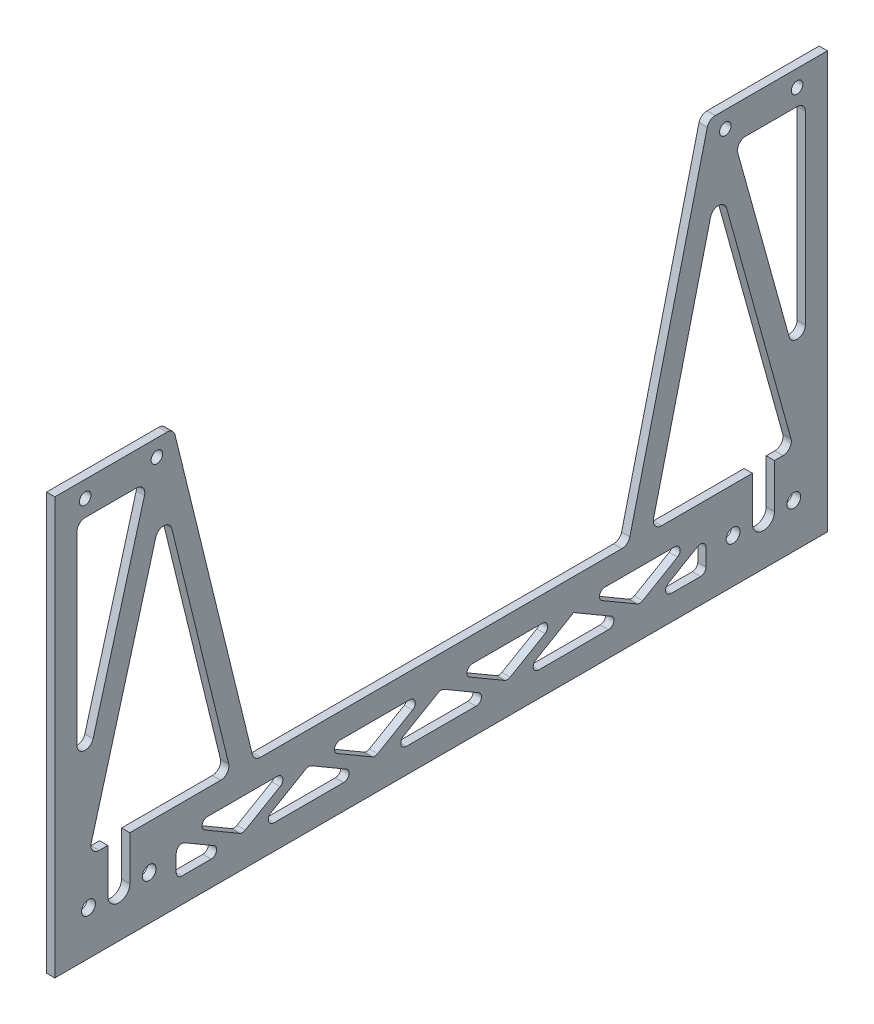
from build123d import *

# Parameters (mm, degrees)
SKETCH1_R           = 1.05
BOSS_EXTRUDE1_DEPTH = 1.5
FILLET1_R           = 1.5
SKETCH2_R           = 1.05
SKETCH2_W           = 4
SKETCH2_H           = 16
BOSS_EXTRUDE2_DEPTH = 1.5
SKETCH4_R           = 1.25
CUT_EXTRUDE2_DEPTH  = 160.067595694
CUT_EXTRUDE4_DEPTH  = 160.067595694
FILLET3_R           = 1
CUT_EXTRUDE5_DEPTH  = 160.067595694
BOSS_EXTRUDE3_DEPTH = 1.5
FILLET4_R           = 1.5


with BuildPart() as part:
    # Sketch1 → Boss-Extrude1 (new body)
    with BuildSketch(Plane(origin=(0, 0, 0), x_dir=(0, 0, -1), z_dir=(1, 0, 0))):
        Polygon((0, 0), (0, 75.5), (21.5, 75.5), (40, 0), (35.881667859, 0), (29.755840045, 25), (4, 25), (4, 0), align=None)
        with Locations((5.5, 72.5)):
            Circle(SKETCH1_R, mode=Mode.SUBTRACT)
        with Locations((18.5, 72.5)):
            Circle(SKETCH1_R, mode=Mode.SUBTRACT)
        Polygon((4, 69.5), (18.851866535, 69.5), (4, 29), align=None, mode=Mode.SUBTRACT)
        Polygon((8.260475549, 29), (20.558388216, 62.535546651), (28.775707595, 29), align=None, mode=Mode.SUBTRACT)
    extrude(amount=BOSS_EXTRUDE1_DEPTH)

    # Fillet1
    fillet1_edges = [part.edges().sort_by_distance(p)[0] for p in [
        (0.75, 75.5, -21.5),
        (0.75, 25, -29.755840045),
        (0.75, 25, -4),
        (0.75, 69.5, -4),
        (0.75, 29, -4),
        (0.75, 69.5, -18.851866535),
        (0.75, 29, -8.260475549),
        (0.75, 29, -28.775707595),
        (0.75, 62.535546651, -20.558388216),
    ]]
    fillet(fillet1_edges, radius=FILLET1_R)

    # Sketch2 → Boss-Extrude2 (add)
    # profile 1 of 5: a face of its own
    with BuildSketch(Plane(origin=(1.5, 0, 0), x_dir=(0, 0, -1), z_dir=(1, 0, 0))):
        Polygon((70, 0), (70, 16), (36.079470199, 16), (40, 0), align=None)
    # profile 2 of 5: a face of its own
    with BuildSketch(Plane(origin=(1.5, 0, 0), x_dir=(0, 0, -1), z_dir=(1, 0, 0))):
        with BuildLine():
            Line((103.920529801, 16), (70, 16))
            Line((70, 16), (70, 0))
            Line((70, 0), (140, 0))
            Line((140, 0), (140, 16))
            Line((140, 16), (140, 75.5))
            Line((140, 75.5), (119.676824884, 75.5))
            ThreePointArc((119.676824884, 75.5), (118.750942408, 75.180144754), (118.219924421, 74.356988855))
            Line((118.219924421, 74.356988855), (103.920529801, 16))
        make_face()
        with BuildLine():
            Line((108.038861942, 16), (109.964084377, 23.856988855))
            ThreePointArc((109.964084377, 23.856988855), (110.495102363, 24.680144754), (111.420984839, 25))
            Line((111.420984839, 25), (134.5, 25))
            ThreePointArc((134.5, 25), (135.560660172, 24.560660172), (136, 23.5))
            Line((136, 23.5), (136, 16))
            Line((136, 16), (108.038861942, 16))
        make_face(mode=Mode.SUBTRACT)
        with BuildLine():
            ThreePointArc((131.000070484, 31.016439186), (130.821545012, 29.641122471), (129.591776989, 29))
            Line((129.591776989, 29), (113.136216627, 29))
            ThreePointArc((113.136216627, 29), (111.956071873, 29.574117524), (111.679316165, 30.856988855))
            Line((111.679316165, 30.856988855), (118.270545293, 57.756329353))
            ThreePointArc((118.270545293, 57.756329353), (119.644098522, 58.897023121), (121.135739251, 57.915779684))
            Line((121.135739251, 57.915779684), (131.000070484, 31.016439186))
        make_face(mode=Mode.SUBTRACT)
        with BuildLine():
            ThreePointArc((121.887587432, 67.483560814), (122.066112904, 68.858877529), (123.295880927, 69.5))
            Line((123.295880927, 69.5), (134.5, 69.5))
            ThreePointArc((134.5, 69.5), (135.560660172, 69.060660172), (136, 68))
            Line((136, 68), (136, 37.447151885))
            ThreePointArc((136, 37.447151885), (134.762259183, 35.970256452), (133.091706505, 36.930712699))
            Line((133.091706505, 36.930712699), (121.887587432, 67.483560814))
        make_face(mode=Mode.SUBTRACT)
        with Locations((121.5, 72.5)):
            Circle(SKETCH2_R, mode=Mode.SUBTRACT)
        with Locations((134.5, 72.5)):
            Circle(SKETCH2_R, mode=Mode.SUBTRACT)
    # profile 3 of 5: a face of its own
    with BuildSketch(Plane(origin=(1.5, 0, 0), x_dir=(0, 0, -1), z_dir=(1, 0, 0))):
        Polygon((35.881667859, 0), (31.961138058, 16), (4, 16), (4, 0), align=None)
    # profile 4 of 5: a face of its own
    with BuildSketch(Plane(origin=(1.5, 0, 0), x_dir=(0, 0, -1), z_dir=(1, 0, 0))):
        Polygon((40, 0), (36.079470199, 16), (31.961138058, 16), (35.881667859, 0), align=None)
    # profile 5 of 5: a face of its own
    with BuildSketch(Plane(origin=(1.5, 0, 0), x_dir=(0, 0, -1), z_dir=(1, 0, 0))):
        with Locations((2, 8)):
            Rectangle(SKETCH2_W, SKETCH2_H)
    extrude(amount=-BOSS_EXTRUDE2_DEPTH)

    # Sketch4 → Cut-Extrude2 (cut, through all)
    with BuildSketch(Plane(origin=(1.5, 0, 0), x_dir=(0, 0, -1), z_dir=(1, 0, 0))):
        with Locations((6.1, 8)):
            Circle(SKETCH4_R)
        with Locations((17.1, 8)):
            Circle(SKETCH4_R)
        with Locations(Location((122.9, 8, 0), (0, 0, 180))):
            Circle(SKETCH4_R)
        with Locations(Location((133.9, 8, 0), (0, 0, 180))):
            Circle(SKETCH4_R)
        with BuildLine():
            Line((130.4, 16), (130.4, 8))
            ThreePointArc((130.4, 8), (128.4, 6), (126.4, 8))
            Line((126.4, 8), (126.4, 16))
            Line((126.4, 16), (130.4, 16))
        make_face()
        with BuildLine():
            Line((13.6, 16), (13.6, 8))
            ThreePointArc((13.6, 8), (11.6, 6), (9.6, 8))
            Line((9.6, 8), (9.6, 16))
            Line((9.6, 16), (13.6, 16))
        make_face()
    extrude(amount=-CUT_EXTRUDE2_DEPTH, mode=Mode.SUBTRACT)

    # Sketch5 → Cut-Extrude4 (cut, through all)
    with BuildSketch(Plane(origin=(1.5, 0, 0), x_dir=(0, 0, -1), z_dir=(1, 0, 0))):
        Polygon((35.984634856, 4.5), (46, 4.5), (56.015365144, 4.5), (46, 10.342296334), align=None)
        Polygon((47.984634856, 11.5), (68.015365144, 11.5), (58, 5.657703666), align=None)
        Polygon((59.984634856, 4.5), (70, 4.5), (80.015365144, 4.5), (70, 10.342296334), align=None)
        Polygon((22, 4.5), (22, 10.342296334), (32.015365144, 4.5), align=None)
        Polygon((23.984634856, 11.5), (44.015365144, 11.5), (34, 5.657703666), align=None)
        Polygon((118, 4.5), (118, 10.342296334), (107.984634856, 4.5), align=None)
        Polygon((94, 4.5), (104.015365144, 4.5), (94, 10.342296334), (83.984634856, 4.5), align=None)
        Polygon((95.984634856, 11.5), (116.015365144, 11.5), (106, 5.657703666), align=None)
        Polygon((71.984634856, 11.5), (92.015365144, 11.5), (82, 5.657703666), align=None)
    extrude(amount=-CUT_EXTRUDE4_DEPTH, mode=Mode.SUBTRACT)

    # Fillet3
    fillet3_edges = [part.edges().sort_by_distance(p)[0] for p in [
        (0.75, 4.5, -83.984634856),
        (0.75, 4.5, -104.015365144),
        (0.75, 4.5, -80.015365144),
        (0.75, 4.5, -59.984634856),
        (0.75, 10.342296334, -70),
        (0.75, 4.5, -56.015365144),
        (0.75, 4.5, -35.984634856),
        (0.75, 10.342296334, -46),
        (0.75, 4.5, -118),
        (0.75, 4.5, -107.984634856),
        (0.75, 10.342296334, -118),
        (0.75, 11.5, -44.015365144),
        (0.75, 5.657703666, -34),
        (0.75, 11.5, -23.984634856),
        (0.75, 5.657703666, -58),
        (0.75, 11.5, -47.984634856),
        (0.75, 11.5, -68.015365144),
        (0.75, 11.5, -116.015365144),
        (0.75, 5.657703666, -106),
        (0.75, 11.5, -95.984634856),
        (0.75, 11.5, -92.015365144),
        (0.75, 5.657703666, -82),
        (0.75, 11.5, -71.984634856),
        (0.75, 4.5, -32.015365144),
        (0.75, 4.5, -22),
        (0.75, 10.342296334, -22),
    ]]
    fillet(fillet3_edges, radius=FILLET3_R)

    # Sketch6 → Cut-Extrude5 (cut, through all)
    with BuildSketch(Plane(origin=(1.5, 0, 0), x_dir=(0, 0, -1), z_dir=(1, 0, 0))):
        Polygon((4, 19.75), (30.998526841, 19.928494428), (18.851866535, 69.5), (4, 69.5), align=None)
        Polygon((136, 69.5), (136, 19.75), (109.001473159, 19.928494428), (121.148133465, 69.5), align=None)
    extrude(amount=-CUT_EXTRUDE5_DEPTH, mode=Mode.SUBTRACT)

    # Sketch7 → Boss-Extrude3 (add)
    with BuildSketch(Plane(origin=(1.5, 0, 0), x_dir=(0, 0, -1), z_dir=(1, 0, 0))):
        Polygon((18.851866535, 69.5), (16.776232149, 69.5), (4, 23.476934928), (4, 16), (6.075634386, 16), (19.825004849, 65.528543637), align=None)
        Polygon((136, 16), (136, 23.476934928), (123.223767851, 69.5), (121.148133465, 69.5), (120.174995151, 65.528543637), (133.924365614, 16), align=None)
    extrude(amount=-BOSS_EXTRUDE3_DEPTH)

    # Fillet4
    fillet4_edges = [part.edges().sort_by_distance(p)[0] for p in [
        (0.75, 16, -31.961138058),
        (0.75, 16, -36.079470199),
        (0.75, 16, -108.038861942),
        (0.75, 16, -103.920529801),
        (0.75, 69.5, -4),
        (0.75, 69.5, -136),
        (0.75, 69.5, -16.776232149),
        (0.75, 23.476934928, -4),
        (0.75, 16, -6.075634386),
        (0.75, 65.528543637, -19.825004849),
        (0.75, 23.476934928, -136),
        (0.75, 69.5, -123.223767851),
        (0.75, 65.528543637, -120.174995151),
        (0.75, 16, -133.924365614),
    ]]
    fillet(fillet4_edges, radius=FILLET4_R)


solid = part.part
